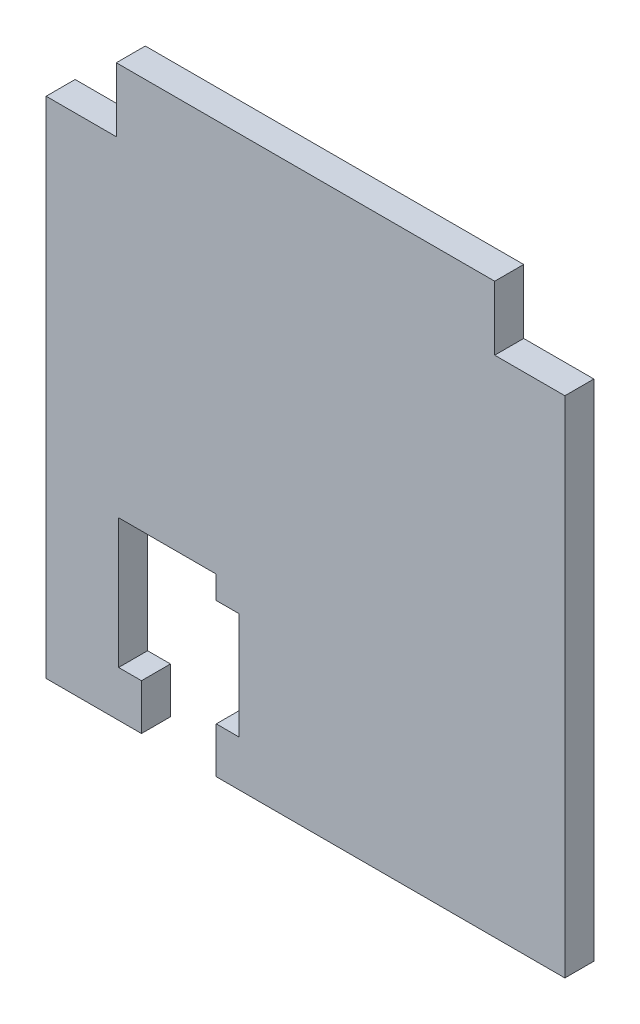
from build123d import *

# Parameters (mm, degrees)
ESQUISSE1_W             = 340
ESQUISSE1_H             = 372.5
BOSS_EXTRU_1_DEPTH      = 19
ESQUISSE2_W             = 46
ESQUISSE2_H             = 42
ENL_V_MAT_EXTRU_1_DEPTH = 253.883495903
ESQUISSE4_W             = 79
ESQUISSE4_H             = 100
ENL_V_MAT_EXTRU_2_DEPTH = 30
ESQUISSE5_W             = 15
ESQUISSE5_H             = 15
BOSS_EXTRU_2_DEPTH      = 19
ESQUISSE6_W             = 49
ESQUISSE6_H             = 15
ENL_V_MAT_EXTRU_3_DEPTH = 20


with BuildPart() as part:
    # Esquisse1 → Boss.-Extru.1 (new body)
    with BuildSketch(Plane.XY):
        Rectangle(ESQUISSE1_W, ESQUISSE1_H)
    extrude(amount=BOSS_EXTRU_1_DEPTH)

    # Esquisse2 → Enlèv. mat.-Extru.1 (cut, through all)
    with BuildSketch(Plane.XY.offset(19)):
        with Locations((-147, 165.25)):
            Rectangle(ESQUISSE2_W, ESQUISSE2_H)
        with Locations((147, 165.25)):
            Rectangle(ESQUISSE2_W, ESQUISSE2_H)
    extrude(amount=-ENL_V_MAT_EXTRU_1_DEPTH, mode=Mode.SUBTRACT)

    # Esquisse4 → Enlèv. mat.-Extru.2 (cut)
    with BuildSketch(Plane.XY.offset(19)):
        with Locations((-83, -121.25)):
            Rectangle(ESQUISSE4_W, ESQUISSE4_H)
    extrude(amount=-ENL_V_MAT_EXTRU_2_DEPTH, mode=Mode.SUBTRACT)

    # Esquisse5 → Boss.-Extru.2 (add)
    with BuildSketch(Plane.XY.offset(19)):
        with Locations((-51, -163.75)):
            Rectangle(ESQUISSE5_W, ESQUISSE5_H)
        with Locations((-115, -163.75)):
            Rectangle(ESQUISSE5_W, ESQUISSE5_H)
        with Locations((-51, -78.75)):
            Rectangle(ESQUISSE5_W, ESQUISSE5_H)
    extrude(amount=-BOSS_EXTRU_2_DEPTH)

    # Esquisse6 → Enlèv. mat.-Extru.3 (cut)
    with BuildSketch(Plane.XY.offset(19)):
        with Locations((-83, -178.75)):
            Rectangle(ESQUISSE6_W, ESQUISSE6_H)
    extrude(amount=-ENL_V_MAT_EXTRU_3_DEPTH, mode=Mode.SUBTRACT)


solid = part.part
